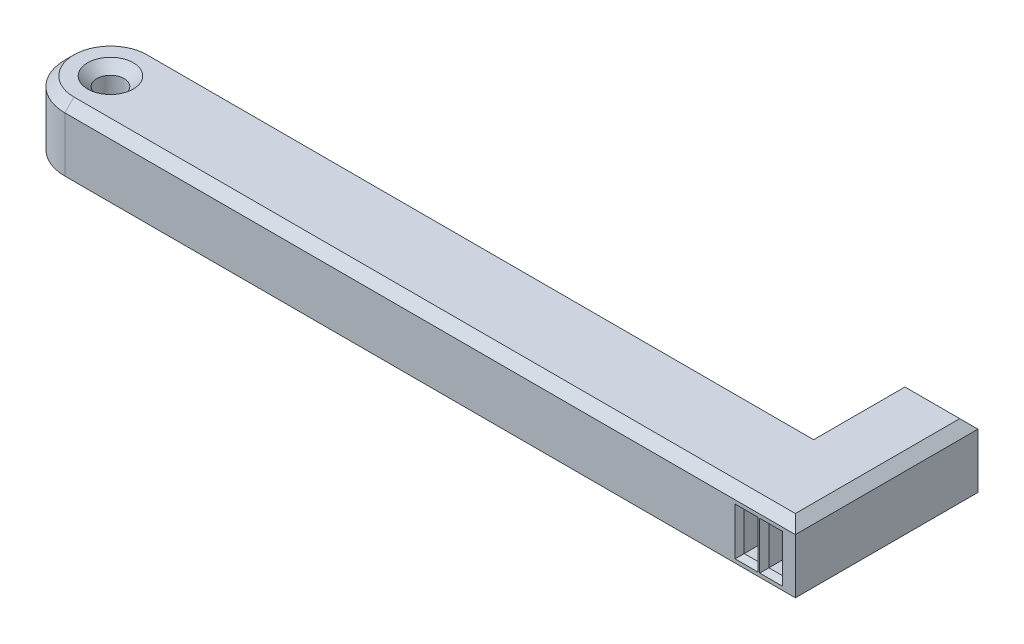
from build123d import *

# Parameters (mm, degrees)
SKETCH1_W           = 8
SKETCH1_H           = 10
SKETCH1_R           = 5
SKETCH1_R_2         = 1.5
BOSS_EXTRUDE1_DEPTH = 8
SKETCH2_W           = 4.2
SKETCH2_H           = 4.2
CUT_EXTRUDE1_DEPTH  = 3.5
SKETCH3_W           = 1.5
SKETCH3_H           = 4.2
CUT_EXTRUDE2_DEPTH  = 83.074661132
CHAMFER1_SIZE       = 1
CHAMFER2_SIZE       = 0.5


with BuildPart() as part:
    # Sketch1 → Boss-Extrude1 (new body)
    # profile 1 of 3: a face of its own
    with BuildSketch(Plane(origin=(0, 0, 0), x_dir=(1, 0, 0), z_dir=(0, 1, 0))):
        with BuildLine():
            Line((72, 5), (0, 5))
            ThreePointArc((0, 5), (3.535533906, 3.535533906), (5, 0))
            ThreePointArc((5, 0), (3.535533906, -3.535533906), (0, -5))
            Line((0, -5), (80, -5))
            Line((80, -5), (80, 5))
            Line((80, 5), (72, 5))
        make_face()
    # profile 2 of 3: a face of its own
    with BuildSketch(Plane(origin=(0, 0, 0), x_dir=(1, 0, 0), z_dir=(0, 1, 0))):
        with Locations((76, 10)):
            Rectangle(SKETCH1_W, SKETCH1_H)
    # profile 3 of 3: a face of its own
    with BuildSketch(Plane(origin=(0, 0, 0), x_dir=(1, 0, 0), z_dir=(0, 1, 0))):
        Circle(SKETCH1_R)
        with Locations(Location((0, 0, 0), (0, 0, 270))):
            Circle(SKETCH1_R_2, mode=Mode.SUBTRACT)
    extrude(amount=BOSS_EXTRUDE1_DEPTH)

    # Sketch2 → Cut-Extrude1 (cut)
    with BuildSketch(Plane(origin=(0, 0, -15), x_dir=(-1, 0, 0), z_dir=(0, 0, -1))):
        with Locations((-76, 4)):
            Rectangle(SKETCH2_W, SKETCH2_H)
    extrude(amount=-CUT_EXTRUDE1_DEPTH, mode=Mode.SUBTRACT)

    # Sketch3 → Cut-Extrude2 (cut, through all)
    with BuildSketch(Plane(origin=(0, 0, -11.5), x_dir=(-1, 0, 0), z_dir=(0, 0, -1))):
        with Locations((-77.35, 4)):
            Rectangle(SKETCH3_W, SKETCH3_H)
        with Locations((-74.65, 4)):
            Rectangle(SKETCH3_W, SKETCH3_H)
    extrude(amount=-CUT_EXTRUDE2_DEPTH, mode=Mode.SUBTRACT)

    # Chamfer1
    chamfer1_edges = [part.edges().sort_by_distance(p)[0] for p in [
        (76, 0, -15),
        (80, 0, -5),
        (40, 0, 5),
        (-5, 0, 0),
        (-5, 8, 0),
        (36, 0, -5),
        (40, 8, 5),
        (80, 8, -5),
        (76, 8, -15),
        (72, 8, -10),
        (0, 8, -1.5),
        (36, 8, -5),
        (0, 0, -1.5),
        (72, 0, -10),
    ]]
    chamfer(chamfer1_edges, length=CHAMFER1_SIZE)

    # Chamfer2
    chamfer2_edges = [part.edges().sort_by_distance(p)[0] for p in [
        (78.1, 4, -15),
        (76, 1.9, -15),
        (73.9, 4, -15),
        (76, 6.1, -15),
        (78.1, 4, 5),
        (77.35, 6.1, 5),
        (76.6, 4, 5),
        (77.35, 1.9, 5),
        (73.9, 4, 5),
        (74.65, 1.9, 5),
        (75.4, 4, 5),
        (74.65, 6.1, 5),
    ]]
    chamfer(chamfer2_edges, length=CHAMFER2_SIZE)


solid = part.part
